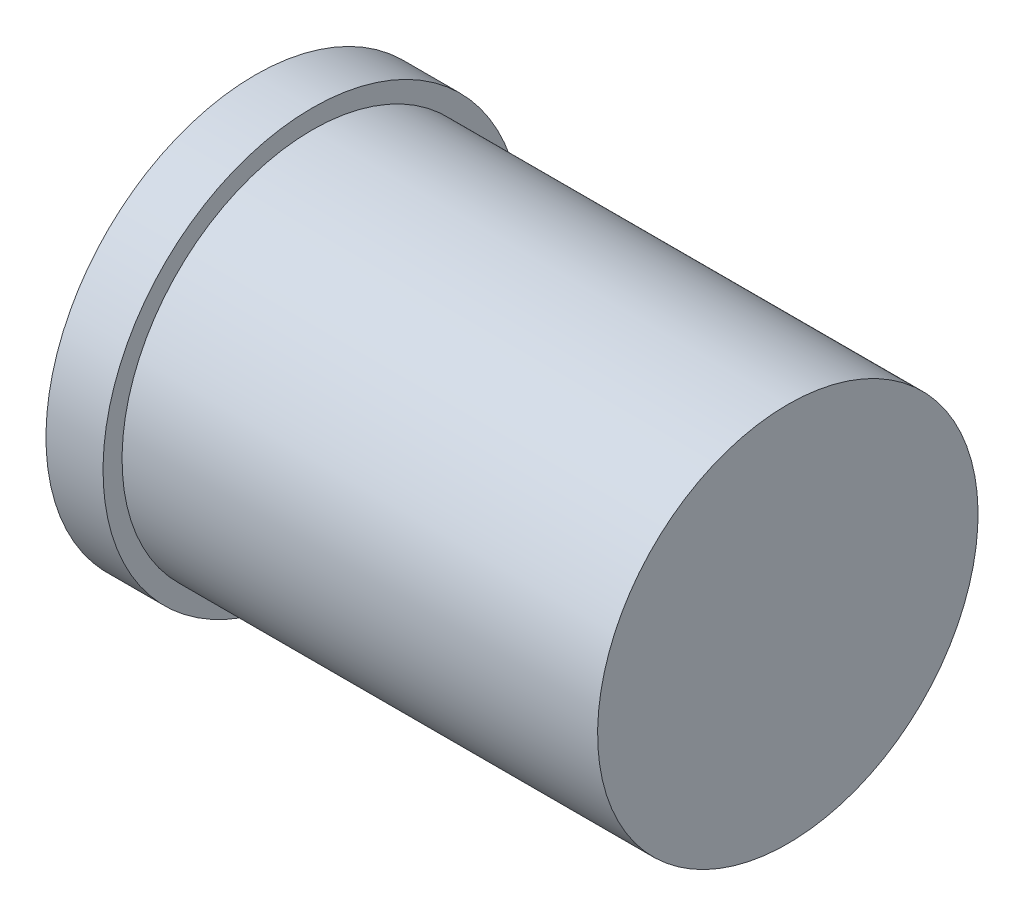
from build123d import *


with BuildPart() as part:
    # Sketch1 → Revolve1 (revolve)
    with BuildSketch(Plane.XY):
        Polygon((0, 0), (0, 11), (3, 11), (3, 10), (28, 10), (28, 0), align=None)
    revolve(axis=Axis((28, 0, 0), (-1, 0, 0)))


solid = part.part
